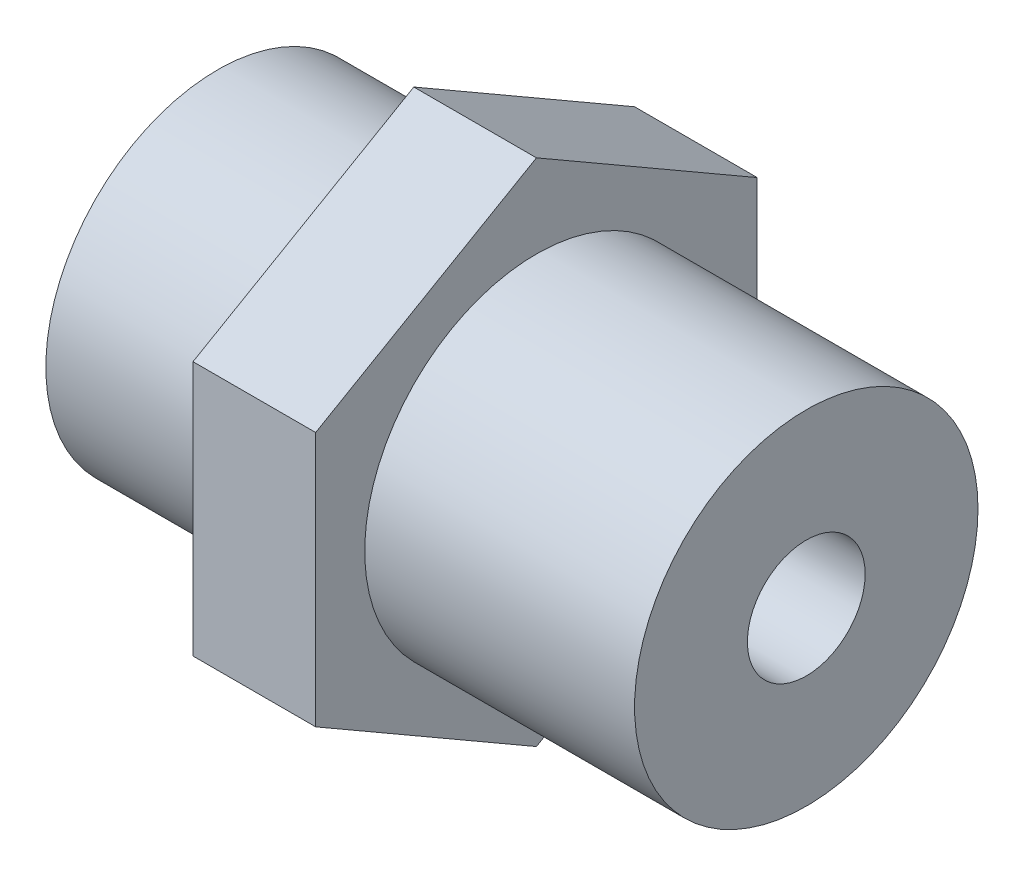
from build123d import *

# Parameters (mm, degrees)
SK_BARRIL_R        = 3.5
SK_BARRIL_R_2      = 1.2
BARRIL_DEPTH       = 12
CONTRATUERCA_START = 2.5
SK_CONTRATUERCA_R  = 1.2
CONTRATUERCA_DEPTH = 2.5


with BuildPart() as part:
    # Sk_barril → Barril (new body)
    with BuildSketch(Plane(origin=(-32, 0, 0), x_dir=(0, 0, -1), z_dir=(1, 0, 0))):
        with Locations((-60.4, -16)):
            Circle(SK_BARRIL_R)
        with Locations((-60.4, -16)):
            Circle(SK_BARRIL_R_2, mode=Mode.SUBTRACT)
    extrude(amount=-BARRIL_DEPTH)

    # Sk_contratuerca → Contratuerca (add)
    with BuildSketch(Plane(origin=(-40, 0, 0), x_dir=(0, 0, -1), z_dir=(1, 0, 0)).offset(CONTRATUERCA_START)):
        Polygon((-60.4, -10.803847577), (-64.9, -13.401923789), (-64.9, -18.598076211), (-60.4, -21.196152423), (-55.9, -18.598076211), (-55.9, -13.401923789), align=None)
        with Locations((-60.4, -16)):
            Circle(SK_CONTRATUERCA_R, mode=Mode.SUBTRACT)
    extrude(amount=-CONTRATUERCA_DEPTH)


solid = part.part
